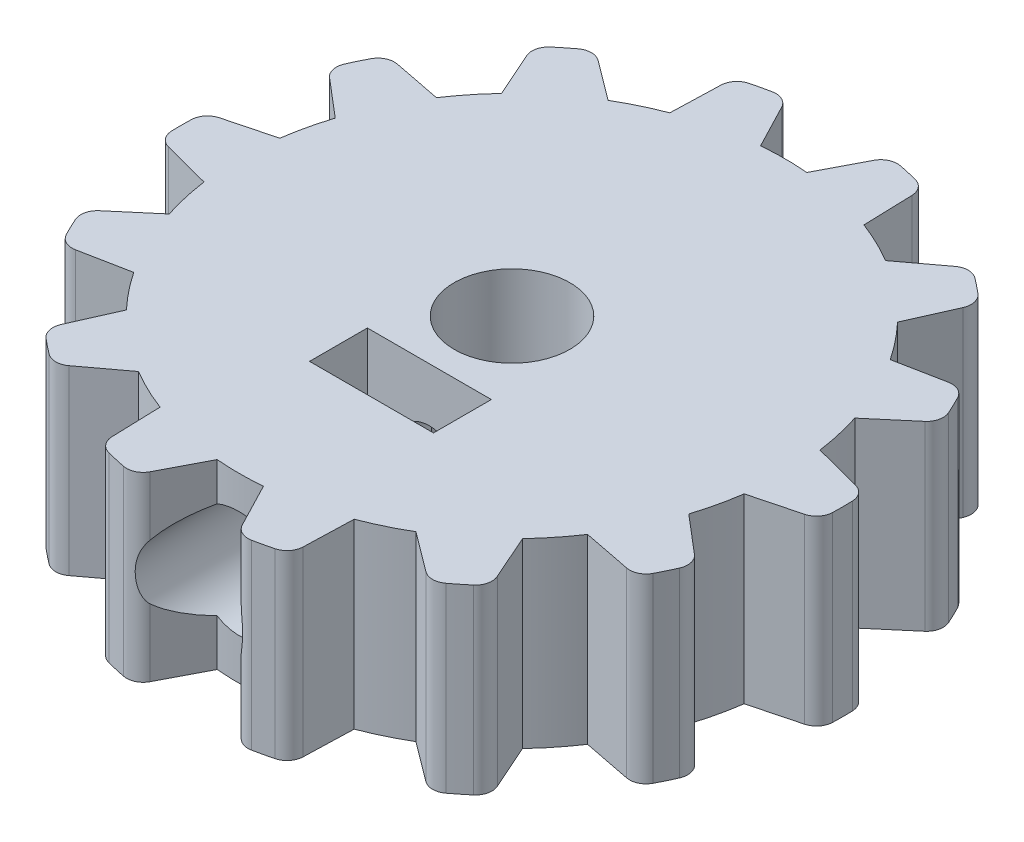
from build123d import *

# Parameters (mm, degrees)
SKETCH1_R                = 20
BOSS_EXTRUDE1_DEPTH      = 11
CUT_EXTRUDE1_REACH       = 32.348
FILLET1_R                = 1
CIRPATTERN1_COUNT        = 14
FILLET1_OF_CIRPATTERN1_R = 1
CUT_EXTRUDE2_REACH       = 32.113
SKETCH3_R                = 3.5
SKETCH4_W                = 7.5
SKETCH4_H                = 3.5
CUT_EXTRUDE3_DEPTH       = 9


with BuildPart() as part:
    # Sketch1 → Boss-Extrude1 (new body)
    with BuildSketch(Plane(origin=(0, 0, 0), x_dir=(1, 0, 0), z_dir=(0, 1, 0))):
        with Locations(Location((0, 0, 0), (0, 0, 270))):
            Circle(SKETCH1_R)
    extrude(amount=BOSS_EXTRUDE1_DEPTH)

    # Sketch2 → Cut-Extrude1 (cut, up to next)
    with BuildSketch(Plane(origin=(0, 11, 0), x_dir=(1, 0, 0), z_dir=(0, 1, 0)), mode=Mode.PRIVATE) as cut_extrude1_sk1:
        with BuildLine():
            Line((-3.125, 19.754350787), (-1.399921321, 16.440505476))
            ThreePointArc((-1.399921321, 16.440505476), (0, 16.5), (1.399921321, 16.440505476))
            Line((1.399921321, 16.440505476), (3.125, 19.754350787))
            ThreePointArc((3.125, 19.754350787), (0, 20), (-3.125, 19.754350787))
        make_face()
    cut_extrude1_tool1 = extrude(cut_extrude1_sk1.sketch, amount=-CUT_EXTRUDE1_REACH, mode=Mode.PRIVATE) & part.part
    cut_extrude1 = cut_extrude1_tool1.solids().sort_by_distance((0, 11, -18.420369))[0]
    add(cut_extrude1, mode=Mode.SUBTRACT)

    # Fillet1
    fillet1_edges = [part.edges().sort_by_distance(p)[0] for p in [
        (-3.125, 5.5, -19.754350787),
        (3.125, 5.5, -19.754350787),
    ]]
    fillet(fillet1_edges, radius=FILLET1_R)

    # CirPattern1: Cut-Extrude1 ×14 about axis
    cirpattern1_axis = Axis((0, 0, 0), (0, 1, 0))
    for i in range(1, CIRPATTERN1_COUNT):
        add(cut_extrude1.rotate(cirpattern1_axis, i * 360 / CIRPATTERN1_COUNT), mode=Mode.SUBTRACT)

    # Fillet1 of CirPattern1
    fillet1_of_cirpattern1_edges = [part.edges().sort_by_distance(p)[0] for p in [
        (-11.386619295, 5.5, -16.44216838),
        (-5.755563871, 5.5, -19.153941749),
        (-17.392978991, 5.5, -9.873412875),
        (-13.49616773, 5.5, -14.75985964),
        (-19.954445887, 5.5, -1.349106861),
        (-18.56369005, 5.5, -7.442406312),
        (-18.56369005, 5.5, 7.442406312),
        (-19.954445887, 5.5, 1.349106861),
        (-13.49616773, 5.5, 14.75985964),
        (-17.392978991, 5.5, 9.873412875),
        (-5.755563871, 5.5, 19.153941749),
        (-11.386619295, 5.5, 16.44216838),
        (3.125, 5.5, 19.754350787),
        (-3.125, 5.5, 19.754350787),
        (11.386619295, 5.5, 16.44216838),
        (5.755563871, 5.5, 19.153941749),
        (17.392978991, 5.5, 9.873412875),
        (13.49616773, 5.5, 14.75985964),
        (19.954445887, 5.5, 1.349106861),
        (18.56369005, 5.5, 7.442406312),
        (18.56369005, 5.5, -7.442406312),
        (19.954445887, 5.5, -1.349106861),
        (13.49616773, 5.5, -14.75985964),
        (17.392978991, 5.5, -9.873412875),
        (5.755563871, 5.5, -19.153941749),
        (11.386619295, 5.5, -16.44216838),
    ]]
    fillet(fillet1_of_cirpattern1_edges, radius=FILLET1_OF_CIRPATTERN1_R)

    # Sketch3 → Cut-Extrude2 (cut, up to next)
    with BuildSketch(Plane(origin=(0, 11, 0), x_dir=(1, 0, 0), z_dir=(0, 1, 0)), mode=Mode.PRIVATE) as cut_extrude2_sk1:
        with Locations(Location((0, 0, 0), (0, 0, 270))):
            Circle(SKETCH3_R)
    cut_extrude2_tool1 = extrude(cut_extrude2_sk1.sketch, amount=-CUT_EXTRUDE2_REACH, mode=Mode.PRIVATE) & part.part
    add(cut_extrude2_tool1.solids().sort_by_distance((0, 11, 0))[0], mode=Mode.SUBTRACT)

    # Sketch4 → Cut-Extrude3 (cut)
    with BuildSketch(Plane(origin=(0, 11, 0), x_dir=(1, 0, 0), z_dir=(0, 1, 0))):
        with Locations((0, -6.75)):
            Rectangle(SKETCH4_W, SKETCH4_H)
    extrude(amount=-CUT_EXTRUDE3_DEPTH, mode=Mode.SUBTRACT)

    # Sketch6 → Cut-Revolve1 (revolve, cut)
    with BuildSketch(Plane(origin=(0, 0, 0), x_dir=(0, 0, -1), z_dir=(1, 0, 0))):
        Polygon((0, 5.75), (0, 7.75), (-10, 7.75), (-10, 9), (-25, 9), (-25, 5.75), align=None)
    revolve(axis=Axis((0, 5.75, 0), (0, 0, 1)), mode=Mode.SUBTRACT)


solid = part.part
